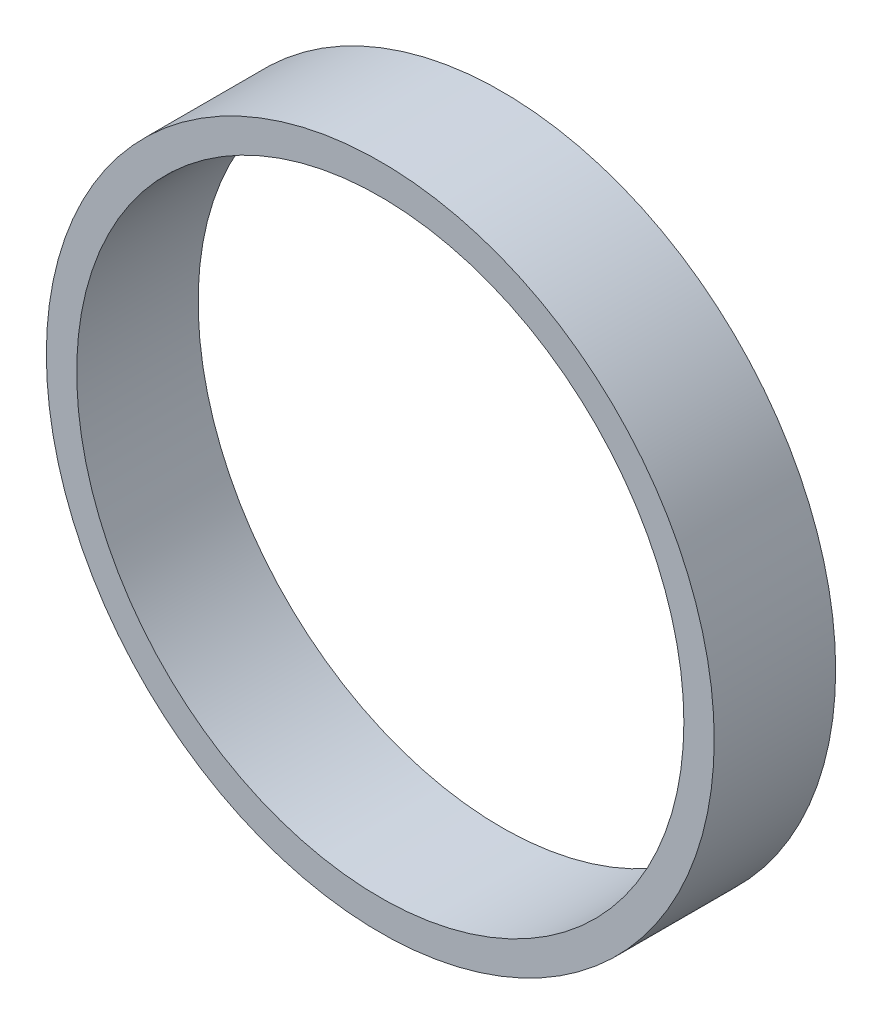
from build123d import *

# Parameters (mm, degrees)
SKIZZE1_R                       = 5.5
SKIZZE1_R_2                     = 5
AUFSATZ_LINEAR_AUSTRAGEN1_DEPTH = 2


with BuildPart() as part:
    # Skizze1 → Aufsatz-Linear austragen1 (new body)
    with BuildSketch(Plane.XY):
        Circle(SKIZZE1_R)
        Circle(SKIZZE1_R_2, mode=Mode.SUBTRACT)
    extrude(amount=AUFSATZ_LINEAR_AUSTRAGEN1_DEPTH)


solid = part.part
